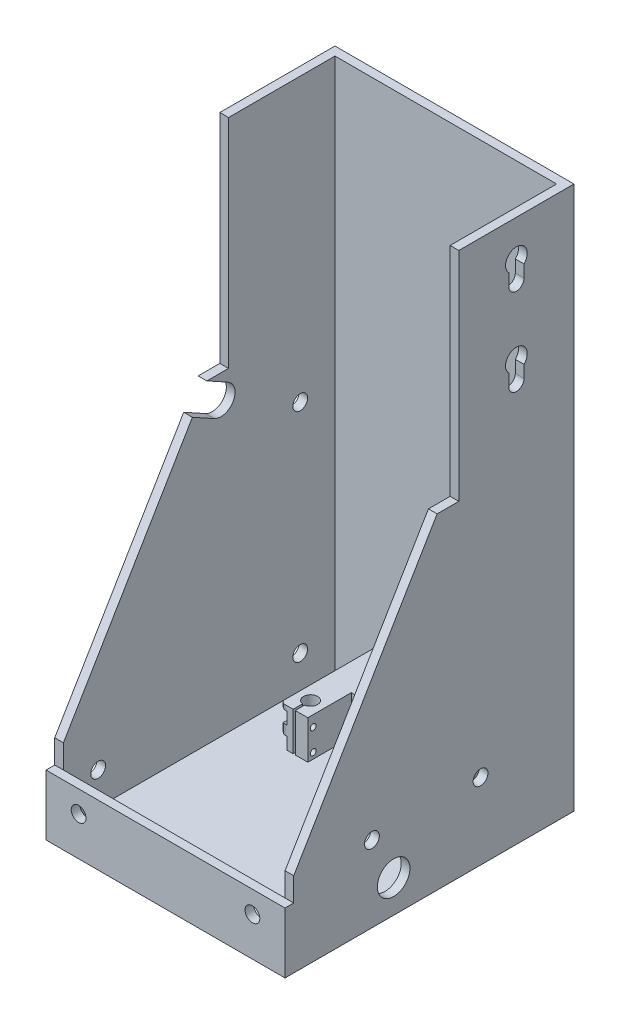
from build123d import *

# Parameters (mm, degrees)
SKETCH3_W           = 110
SKETCH3_H           = 133
BOSS_EXTRUDE1_DEPTH = 5
SKETCH4_W           = 110
SKETCH4_H           = 133
SKETCH4_W_2         = 102
SKETCH4_H_2         = 125
BOSS_EXTRUDE2_DEPTH = 245
CUT_EXTRUDE1_DEPTH  = 282.108964638
SKETCH6_W           = 62.5
SKETCH6_H           = 25
BOSS_EXTRUDE3_DEPTH = 20
SKETCH7_R           = 2.75
CUT_EXTRUDE2_DEPTH  = 20
SKETCH8_W           = 12.5
SKETCH8_H           = 20
BOSS_EXTRUDE4_DEPTH = 20
SKETCH9_R           = 3.25
CUT_EXTRUDE3_DEPTH  = 20
SKETCH10_W          = 20
SKETCH10_H          = 2.25
CUT_EXTRUDE4_DEPTH  = 12.6
SKETCH12_W          = 20
SKETCH12_H          = 2.25
CUT_EXTRUDE5_DEPTH  = 12.6
FILLET1_R           = 2
FILLET2_R           = 2
SKETCH13_W          = 1
SKETCH13_H          = 5.289798983
CUT_EXTRUDE6_DEPTH  = 20
SKETCH14_R          = 1.375
CUT_EXTRUDE7_DEPTH  = 20
SKETCH15_R          = 1.375
CUT_EXTRUDE8_DEPTH  = 20
SKETCH16_R          = 3.75
CUT_EXTRUDE9_DEPTH  = 3
CUT_EXTRUDE10_START = -3
SKETCH17_R          = 3.75
CUT_EXTRUDE10_DEPTH = 3
SKETCH18_R          = 3.41
CUT_EXTRUDE11_DEPTH = 5
SKETCH19_R          = 3.41
CUT_EXTRUDE12_DEPTH = 5
CUT_EXTRUDE13_DEPTH = 5
SKETCH21_R          = 7.5
CUT_EXTRUDE14_DEPTH = 5
SKETCH22_R          = 3.41
CUT_EXTRUDE15_DEPTH = 5
CUT_EXTRUDE16_DEPTH = 5


with BuildPart() as part:
    # Sketch3 → Boss-Extrude1 (new body)
    with BuildSketch(Plane(origin=(0, 0, 0), x_dir=(1, 0, 0), z_dir=(0, 1, 0))):
        Rectangle(SKETCH3_W, SKETCH3_H)
    extrude(amount=BOSS_EXTRUDE1_DEPTH)

    # Sketch4 → Boss-Extrude2 (add)
    with BuildSketch(Plane(origin=(0, 5, 0), x_dir=(1, 0, 0), z_dir=(0, 1, 0))):
        Rectangle(SKETCH4_W, SKETCH4_H)
        Rectangle(SKETCH4_W_2, SKETCH4_H_2, mode=Mode.SUBTRACT)
    extrude(amount=BOSS_EXTRUDE2_DEPTH)

    # Sketch5 → Cut-Extrude1 (cut, through all)
    with BuildSketch(Plane.ZY.offset(55)):
        Polygon((-13.5, 250), (-13.5, 150), (-3.5, 150), (62.5, 38.76), (62.5, 27.9), (66.5, 27.9), (66.5, 250), align=None)
    extrude(amount=-CUT_EXTRUDE1_DEPTH, mode=Mode.SUBTRACT)

    # Sketch6 → Boss-Extrude3 (add)
    with BuildSketch(Plane(origin=(0, 5, 0), x_dir=(1, 0, 0), z_dir=(0, 1, 0))):
        with Locations((0.25, 50)):
            Rectangle(SKETCH6_W, SKETCH6_H)
    extrude(amount=BOSS_EXTRUDE3_DEPTH)

    # Sketch7 → Cut-Extrude2 (cut)
    with BuildSketch(Plane(origin=(0, 25, 0), x_dir=(1, 0, 0), z_dir=(0, 1, 0))):
        with Locations(Location((0.25, 45, 0), (0, 0, 270))):
            Circle(SKETCH7_R)
    extrude(amount=-CUT_EXTRUDE2_DEPTH, mode=Mode.SUBTRACT)

    # Sketch8 → Boss-Extrude4 (add)
    with BuildSketch(Plane(origin=(0, 5, 0), x_dir=(1, 0, 0), z_dir=(0, 1, 0))):
        with Locations((-24.75, 27.5)):
            Rectangle(SKETCH8_W, SKETCH8_H)
        with Locations((25.25, 27.5)):
            Rectangle(SKETCH8_W, SKETCH8_H)
    extrude(amount=BOSS_EXTRUDE4_DEPTH)

    # Sketch9 → Cut-Extrude3 (cut)
    with BuildSketch(Plane(origin=(0, 25, 0), x_dir=(1, 0, 0), z_dir=(0, 1, 0))):
        with Locations(Location((-24.75, 25, 0), (0, 0, 270))):
            Circle(SKETCH9_R)
        with Locations(Location((25.25, 25, 0), (0, 0, 270))):
            Circle(SKETCH9_R)
    extrude(amount=-CUT_EXTRUDE3_DEPTH, mode=Mode.SUBTRACT)

    # Sketch10 → Cut-Extrude4 (cut)
    with BuildSketch(Plane(origin=(-18.5, 0, 0), x_dir=(0, 0, -1), z_dir=(1, 0, 0))):
        with Locations((27.5, 6.125)):
            Rectangle(SKETCH10_W, SKETCH10_H)
    extrude(amount=-CUT_EXTRUDE4_DEPTH, mode=Mode.SUBTRACT)

    # Sketch12 → Cut-Extrude5 (cut)
    with BuildSketch(Plane.ZY.offset(-19)):
        with Locations((-27.5, 6.125)):
            Rectangle(SKETCH12_W, SKETCH12_H)
    extrude(amount=-CUT_EXTRUDE5_DEPTH, mode=Mode.SUBTRACT)

    # Fillet1
    fillet1_edges = [part.edges().sort_by_distance(p)[0] for p in [
        (31.5, 16.125, -17.5),
    ]]
    fillet(fillet1_edges, radius=FILLET1_R)

    # Fillet2
    fillet2_edges = [part.edges().sort_by_distance(p)[0] for p in [
        (-31, 16.125, -17.5),
    ]]
    fillet(fillet2_edges, radius=FILLET2_R)

    # Sketch13 → Cut-Extrude6 (cut)
    with BuildSketch(Plane(origin=(0, 25, 0), x_dir=(1, 0, 0), z_dir=(0, 1, 0))):
        with Locations((25.25, 20.144899491)):
            Rectangle(SKETCH13_W, SKETCH13_H)
        with Locations((-24.75, 20.144899491)):
            Rectangle(SKETCH13_W, SKETCH13_H)
    extrude(amount=-CUT_EXTRUDE6_DEPTH, mode=Mode.SUBTRACT)

    # Sketch14 → Cut-Extrude7 (cut)
    with BuildSketch(Plane(origin=(-18.5, 0, 0), x_dir=(0, 0, -1), z_dir=(1, 0, 0))):
        with Locations((20, 20)):
            Circle(SKETCH14_R)
        with Locations((20, 10)):
            Circle(SKETCH14_R)
    extrude(amount=-CUT_EXTRUDE7_DEPTH, mode=Mode.SUBTRACT)

    # Sketch15 → Cut-Extrude8 (cut)
    with BuildSketch(Plane.ZY.offset(-19)):
        with Locations((-19.75, 20)):
            Circle(SKETCH15_R)
        with Locations((-19.75, 10)):
            Circle(SKETCH15_R)
    extrude(amount=-CUT_EXTRUDE8_DEPTH, mode=Mode.SUBTRACT)

    # Sketch16 → Cut-Extrude9 (cut)
    with BuildSketch(Plane.ZY.offset(31)):
        with Locations((-20, 20)):
            Circle(SKETCH16_R)
        with Locations((-20, 10)):
            Circle(SKETCH16_R)
    extrude(amount=-CUT_EXTRUDE9_DEPTH, mode=Mode.SUBTRACT)

    # Sketch17 → Cut-Extrude10 (cut)
    with BuildSketch(Plane(origin=(31.5, 0, 0), x_dir=(0, 0, -1), z_dir=(1, 0, 0)).offset(CUT_EXTRUDE10_START)):
        with Locations((20, 20)):
            Circle(SKETCH17_R)
        with Locations((20, 10)):
            Circle(SKETCH17_R)
    extrude(amount=CUT_EXTRUDE10_DEPTH, mode=Mode.SUBTRACT)

    # Sketch18 → Cut-Extrude11 (cut)
    with BuildSketch(Plane.XY.offset(66.5)):
        with Locations((-40, 17.9)):
            Circle(SKETCH18_R)
        with Locations((40, 17.9)):
            Circle(SKETCH18_R)
    extrude(amount=-CUT_EXTRUDE11_DEPTH, mode=Mode.SUBTRACT)

    # Sketch19 → Cut-Extrude12 (cut)
    with BuildSketch(Plane.ZY.offset(55)):
        with Locations((-46.5, 120)):
            Circle(SKETCH19_R)
        with Locations((-46.5, 20)):
            Circle(SKETCH19_R)
        with Locations((46.5, 20)):
            Circle(SKETCH19_R)
    extrude(amount=-CUT_EXTRUDE12_DEPTH, mode=Mode.SUBTRACT)

    # Sketch20 → Cut-Extrude13 (cut)
    with BuildSketch(Plane.ZY.offset(55)):
        with BuildLine():
            Line((3.133380894, 138.819738021), (-6.861130368, 133.308120044))
            ThreePointArc((-6.861130368, 133.308120044), (-15.692800866, 135.862800883), (-13.135528331, 144.693721286))
            Line((-13.135528331, 144.693721286), (-3.5, 150))
            Line((-3.5, 150), (3.133380894, 138.819738021))
        make_face()
    extrude(amount=-CUT_EXTRUDE13_DEPTH, mode=Mode.SUBTRACT)

    # Sketch21 → Cut-Extrude14 (cut)
    with BuildSketch(Plane(origin=(55, 0, 0), x_dir=(0, 0, -1), z_dir=(1, 0, 0))):
        with Locations((-16.5, 15)):
            Circle(SKETCH21_R)
    extrude(amount=-CUT_EXTRUDE14_DEPTH, mode=Mode.SUBTRACT)

    # Sketch22 → Cut-Extrude15 (cut)
    with BuildSketch(Plane(origin=(55, 0, 0), x_dir=(0, 0, -1), z_dir=(1, 0, 0))):
        with Locations((-26.5, 35)):
            Circle(SKETCH22_R)
        with Locations((23.5, 35)):
            Circle(SKETCH22_R)
    extrude(amount=-CUT_EXTRUDE15_DEPTH, mode=Mode.SUBTRACT)

    # Sketch23 → Cut-Extrude16 (cut)
    with BuildSketch(Plane(origin=(55, 0, 0), x_dir=(0, 0, -1), z_dir=(1, 0, 0))):
        with BuildLine():
            Line((36.5, 224), (36.5, 229.629285786))
            ThreePointArc((36.5, 229.629285786), (40, 238.2), (43.5, 229.629285786))
            Line((43.5, 229.629285786), (43.5, 224))
            ThreePointArc((43.5, 224), (40, 220.5), (36.5, 224))
        make_face()
        with BuildLine():
            Line((36.5, 184), (36.5, 189.629285786))
            ThreePointArc((36.5, 189.629285786), (40, 198.2), (43.5, 189.629285786))
            Line((43.5, 189.629285786), (43.5, 184))
            ThreePointArc((43.5, 184), (40, 180.5), (36.5, 184))
        make_face()
    extrude(amount=-CUT_EXTRUDE16_DEPTH, mode=Mode.SUBTRACT)


solid = part.part
